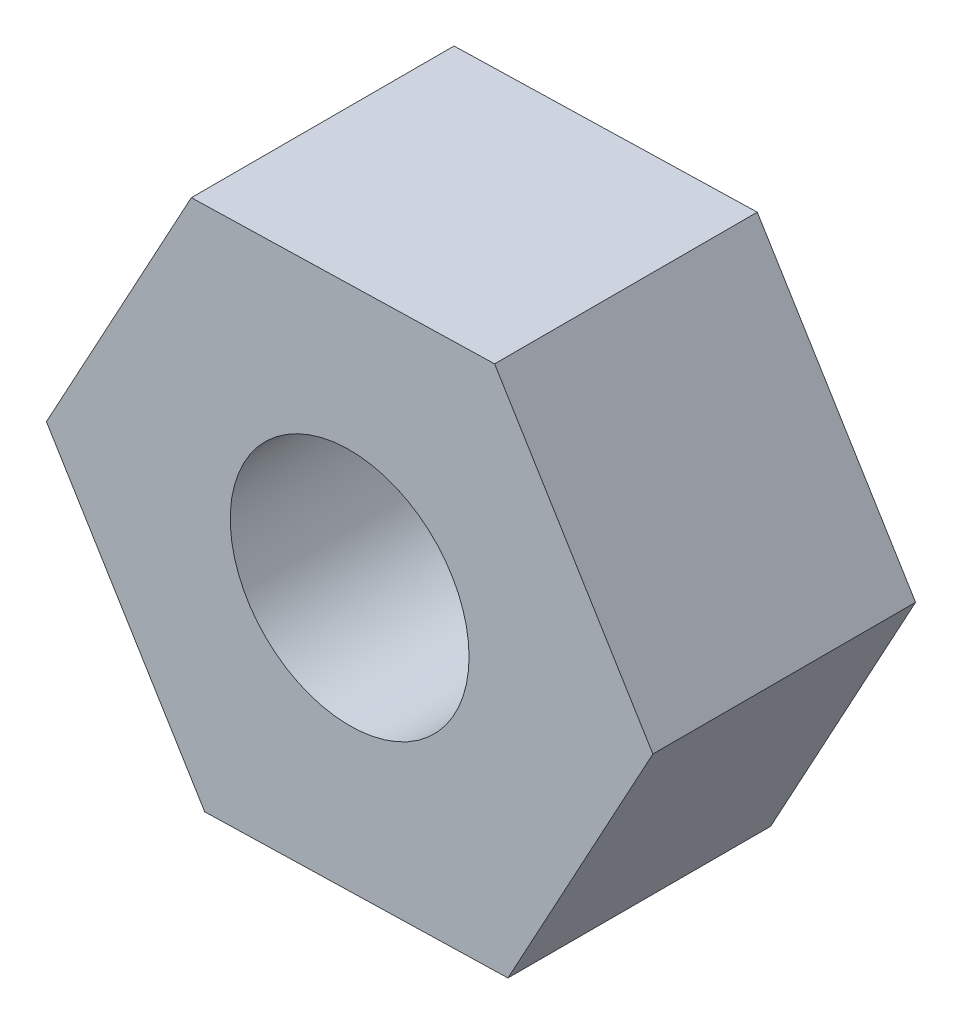
from build123d import *

# Parameters (mm, degrees)
CROQUIS1_R              = 2.5
SALIENTE_EXTRUIR1_DEPTH = 5.5


with BuildPart() as part:
    # Croquis1 → Saliente-Extruir1 (new body)
    with BuildSketch(Plane.XY):
        Polygon((3.314230015, -5.41749137), (6.348800158, 0.161461702), (3.034570144, 5.578953072), (-3.314230015, 5.41749137), (-6.348800158, -0.161461702), (-3.034570144, -5.578953072), align=None)
        Circle(CROQUIS1_R, mode=Mode.SUBTRACT)
    extrude(amount=SALIENTE_EXTRUIR1_DEPTH)


solid = part.part
